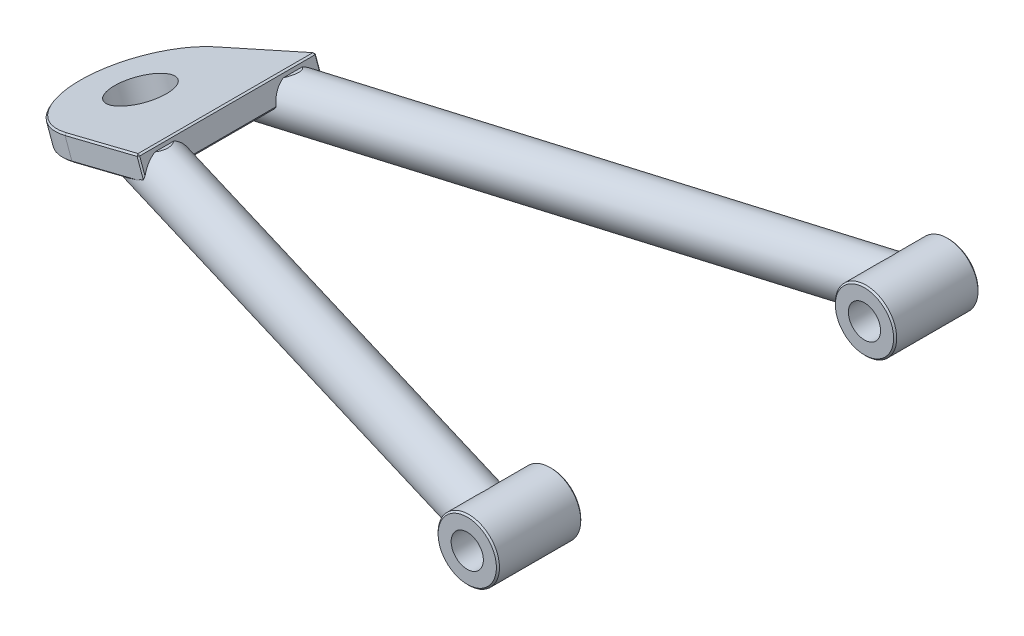
from build123d import *
from OCP.BRepFilletAPI import BRepFilletAPI_MakeChamfer

# Parameters (mm, degrees)
SKETCH1_W                = 9.5
SKETCH1_H                = 55
BOSS_EXTRUDE1_REACH      = 418.864
BOSS_EXTRUDE1_END_RADIUS = 20
SKETCH2_R                = 15.5
SKETCH2_R_2              = 12.65
BOSS_EXTRUDE2_REACH      = 418.864
BOSS_EXTRUDE2_END_RADIUS = 20
SKETCH3_R                = 15.5
SKETCH3_R_2              = 12.65
SKETCH9_W                = 200
SKETCH9_H                = 33.234380705
CUT_EXTRUDE2_DEPTH       = 198.5
SKETCH8_R                = 18
BOSS_EXTRUDE3_DEPTH      = 15
CHAMFER1_SIZE            = 1
CHAMFER2_SIZE            = 1
CHAMFER2_SIZE2           = 0.883191486
CHAMFER3_SIZE            = 1


with BuildPart() as part:
    # Sketch1 → Revolve1 (revolve)
    with BuildSketch(Plane(origin=(0, 0, 0), x_dir=(1, 0, 0), z_dir=(0, 1, 0)), mode=Mode.PRIVATE) as revolve1_sk:
        with Locations((-4.75, 129.48)):
            Rectangle(SKETCH1_W, SKETCH1_H)
        with Locations((-4.75, -129.48)):
            Rectangle(SKETCH1_W, SKETCH1_H)
    revolve(revolve1_sk.sketch.rotate(Axis((10.5, 0, -101.98), (0, 0, -1)), 180), axis=Axis((10.5, 0, -101.98), (0, 0, -1)))

    # Boss-Extrude1: up to this cylinder (the profile starts outside it)
    boss_extrude1_end = Plane(origin=(10.5, 0, -44.427968), z_dir=(0, 0, 1)) * Cylinder(BOSS_EXTRUDE1_END_RADIUS, 878.728, mode=Mode.PRIVATE)
    # Sketch2 → Boss-Extrude1 (add, up to the surface)
    with BuildSketch(Plane(origin=(-341.54, 0, -30), x_dir=(0.28699849189640086, 0, 0.9579310338689272), z_dir=(-0.9579310338689272, 0, 0.28699849189640086)), mode=Mode.PRIVATE) as boss_extrude1_sk1:
        Circle(SKETCH2_R)
        Circle(SKETCH2_R_2, mode=Mode.SUBTRACT)
    boss_extrude1_tool1 = extrude(boss_extrude1_sk1.sketch, amount=-BOSS_EXTRUDE1_REACH, mode=Mode.PRIVATE) - boss_extrude1_end
    add(boss_extrude1_tool1.solids().sort_by_distance((-345.862655, 0, -44.427968))[0])

    # Boss-Extrude2: up to this cylinder (the profile starts outside it)
    boss_extrude2_end = Plane(origin=(10.5, 0, 15.572032), z_dir=(0, 0, 1)) * Cylinder(BOSS_EXTRUDE2_END_RADIUS, 878.728, mode=Mode.PRIVATE)
    # Sketch3 → Boss-Extrude2 (add, up to the surface)
    with BuildSketch(Plane(origin=(-341.54, 0, 30), x_dir=(-0.28699849189640053, 0, 0.9579310338689273), z_dir=(-0.9579310338689273, 0, -0.28699849189640053)), mode=Mode.PRIVATE) as boss_extrude2_sk1:
        Circle(SKETCH3_R)
        Circle(SKETCH3_R_2, mode=Mode.SUBTRACT)
    boss_extrude2_tool1 = extrude(boss_extrude2_sk1.sketch, amount=-BOSS_EXTRUDE2_REACH, mode=Mode.PRIVATE) - boss_extrude2_end
    add(boss_extrude2_tool1.solids().sort_by_distance((-337.217345, 0, 15.572032))[0])

    # Sketch9 → Cut-Extrude2 (cut, symmetric)
    with BuildSketch(Plane(origin=(-301.587409551, -109.768840106, 0), x_dir=(0, 0, 1), z_dir=(-0.9396926207859128, -0.34202014332565694, 0))):
        with Locations((0, 133.430750104)):
            Rectangle(SKETCH9_W, SKETCH9_H)
    extrude(amount=CUT_EXTRUDE2_DEPTH, both=True, mode=Mode.SUBTRACT)

    # Sketch8 → Boss-Extrude3 (add)
    with BuildSketch(Plane(origin=(-35.886958817, 98.598609003, 0), x_dir=(0, 0, -1), z_dir=(-0.34202014332565694, 0.9396926207859128, 0))):
        with BuildLine():
            Line((-58.125498382, 278.942617703), (58.125498382, 278.942617703))
            Line((58.125498382, 278.942617703), (49.490055464, 338.942617703))
            ThreePointArc((49.490055464, 338.942617703), (0, 381.819808554), (-49.490055464, 338.942617703))
            Line((-49.490055464, 338.942617703), (-58.125498382, 278.942617703))
        make_face()
        with Locations(Location((0, 338.942617703, 0), (0, 0, 90))):
            Circle(SKETCH8_R, mode=Mode.SUBTRACT)
    extrude(amount=BOSS_EXTRUDE3_DEPTH)

    # Chamfer1
    chamfer1_edges = [part.edges().sort_by_distance(p)[0] for p in [
        (-9.5, 0, -156.98),
        (-9.5, 0, -101.98),
        (-9.5, 0, 101.98),
        (-9.5, 0, 156.98),
    ]]
    chamfer(chamfer1_edges, length=CHAMFER1_SIZE)

    # Chamfer2: one chamfer whose edges measure the first distance from different faces: ONE call of the kernel's chamfer builder (chamfer() names one face for all edges)
    chamfer2_edges_1 = [part.edges().sort_by_distance(p)[0] for p in [
        (-298.007278296, 3.194614917, 0),
        (-303.137580446, 17.290004229, 0),
        (-331.328359069, 7.029399929, -53.807776923),
        (-331.328359069, 7.029399929, 53.807776923),
        (-399.810517535, -17.896067331, 0),
        (-329.918850493, -8.420247491, -53.237897301),
        (-329.918850493, -8.420247491, 53.237897301),
        (-394.680215385, -31.991456643, 0),
    ]]
    chamfer2_edges_2 = [part.edges().sort_by_distance(p)[0] for p in [
        (-300.914930544, 11.183323814, -58.125498382),
    ]]
    chamfer2_side_2 = [part.faces().sort_by_distance(p)[0] for p in [
        (-300.973675486, 11.344724214, 0),
    ]]
    chamfer2_edges_3 = [part.edges().sort_by_distance(p)[0] for p in [
        (-300.914930544, 11.183323814, 58.125498382),
    ]]
    chamfer2_side_3 = [part.faces().sort_by_distance(p)[0] for p in [
        (-329.11686309, -0.055580808, 53.758111659),
    ]]
    chamfer2 = BRepFilletAPI_MakeChamfer(part.part.solid().wrapped)
    for e in chamfer2_edges_1:
        chamfer2.Add(CHAMFER2_SIZE, e.wrapped)
    for e in chamfer2_edges_2:
        chamfer2.Add(CHAMFER2_SIZE, CHAMFER2_SIZE2, e.wrapped, chamfer2_side_2[0].wrapped)  # the first distance lies on this face
    for e in chamfer2_edges_3:
        chamfer2.Add(CHAMFER2_SIZE, CHAMFER2_SIZE2, e.wrapped, chamfer2_side_3[0].wrapped)  # the first distance lies on this face
    add(Compound.cast(chamfer2.Shape()), mode=Mode.REPLACE)

    # Chamfer3
    chamfer3_edges = [part.edges().sort_by_distance(p)[0] for p in [
        (-341.07783166, -15.416120436, -28.457394695),
        (-341.07783166, -15.416120436, 28.457394695),
    ]]
    chamfer(chamfer3_edges, length=CHAMFER3_SIZE)


solid = part.part
